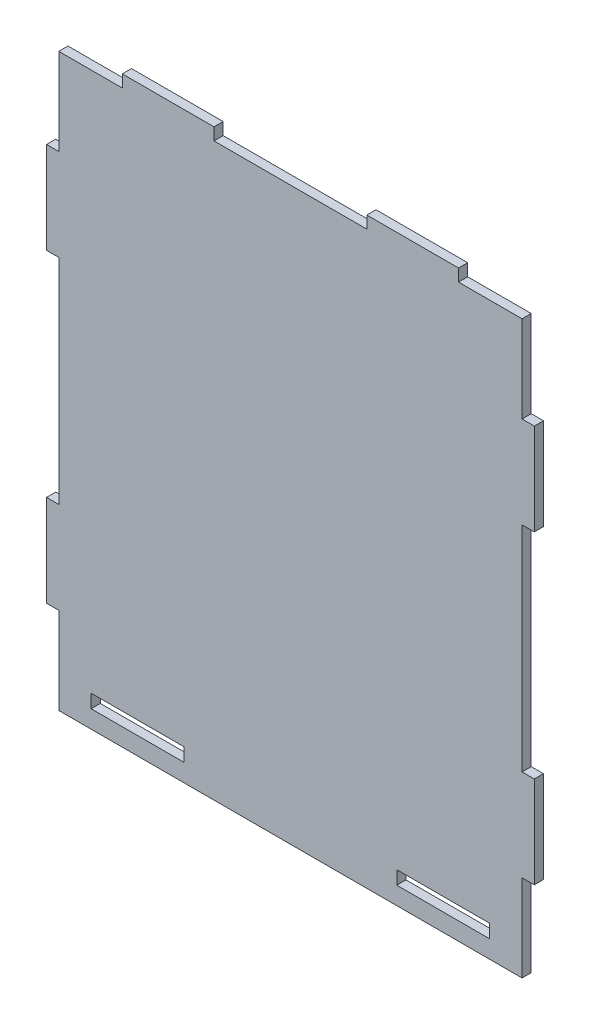
from build123d import *

# Parameters (mm, degrees)
SKETCH_1_W      = 151.6
SKETCH_1_H      = 186.8
SKETCH_1_W_2    = 30.4
SKETCH_1_H_2    = 4.4
SKETCH_1_W_3    = 4
SKETCH_1_H_3    = 30
SKETCH_1_W_4    = 30
SKETCH_1_H_4    = 4
EXTRUDE_1_DEPTH = 3


with BuildPart() as part:
    # Эскиз1 → Бобышка-Вытянуть1 (new body)
    # profile 1 of 7: a face of its own
    with BuildSketch(Plane.XY):
        with Locations((75.8, 93.4)):
            Rectangle(SKETCH_1_W, SKETCH_1_H)
        with Locations((25.8, 8)):
            Rectangle(SKETCH_1_W_2, SKETCH_1_H_2, mode=Mode.SUBTRACT)
        with Locations((125.8, 8)):
            Rectangle(SKETCH_1_W_2, SKETCH_1_H_2, mode=Mode.SUBTRACT)
    # profile 2 of 7: a face of its own
    with BuildSketch(Plane.XY):
        with Locations((-2, 43.4)):
            Rectangle(SKETCH_1_W_3, SKETCH_1_H_3)
    # profile 3 of 7: a face of its own
    with BuildSketch(Plane.XY):
        with Locations((-2, 143.4)):
            Rectangle(SKETCH_1_W_3, SKETCH_1_H_3)
    # profile 4 of 7: a face of its own
    with BuildSketch(Plane.XY):
        with Locations((153.6, 143.4)):
            Rectangle(SKETCH_1_W_3, SKETCH_1_H_3)
    # profile 5 of 7: a face of its own
    with BuildSketch(Plane.XY):
        with Locations((153.6, 43.4)):
            Rectangle(SKETCH_1_W_3, SKETCH_1_H_3)
    # profile 6 of 7: a face of its own
    with BuildSketch(Plane.XY):
        with Locations((35.8, 188.8)):
            Rectangle(SKETCH_1_W_4, SKETCH_1_H_4)
    # profile 7 of 7: a face of its own
    with BuildSketch(Plane.XY):
        with Locations((115.8, 188.8)):
            Rectangle(SKETCH_1_W_4, SKETCH_1_H_4)
    extrude(amount=EXTRUDE_1_DEPTH)


solid = part.part
